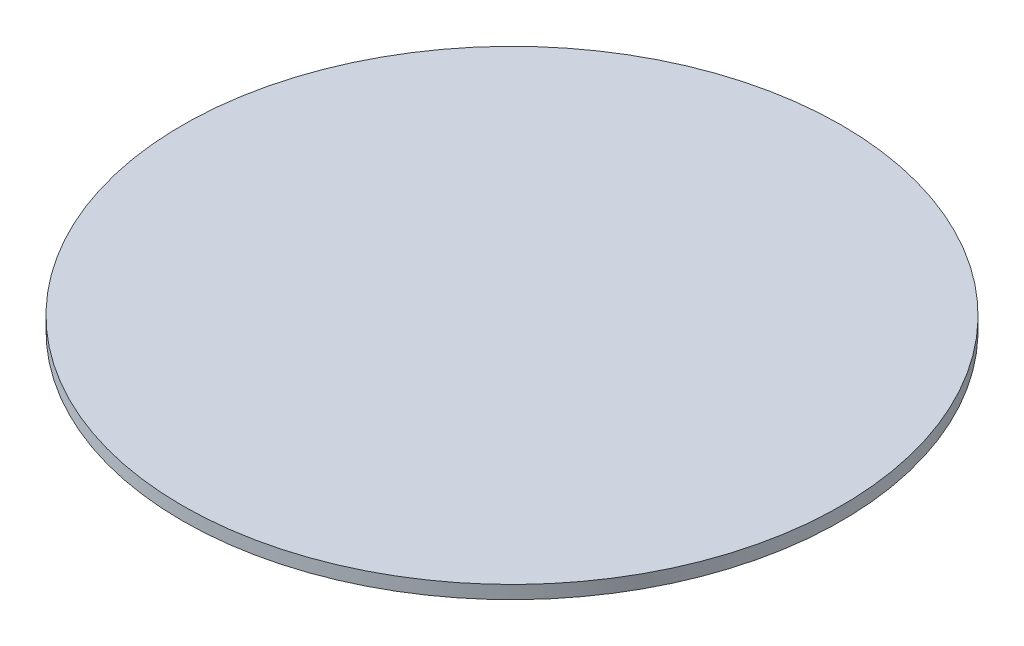
from build123d import *

# Parameters (mm, degrees)
SKETCH1_R           = 250
BOSS_EXTRUDE1_DEPTH = 10


with BuildPart() as part:
    # Sketch1 → Boss-Extrude1 (new body)
    with BuildSketch(Plane(origin=(0, 0, 0), x_dir=(1, 0, 0), z_dir=(0, 1, 0))):
        with Locations(Location((0, 0, 0), (0, 0, 270))):
            Circle(SKETCH1_R)
    extrude(amount=BOSS_EXTRUDE1_DEPTH)


solid = part.part
